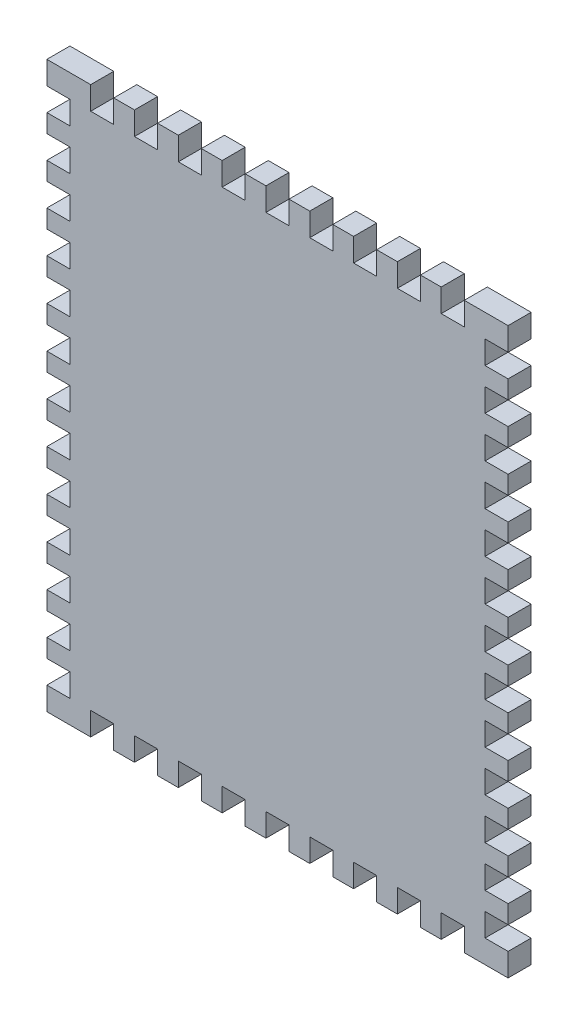
from build123d import *

# Parameters (mm, degrees)
ESBO_O1_W                = 120
ESBO_O1_H                = 147
RESSALTO_EXTRUS_O1_DEPTH = 6
CORTE_EXTRUS_O1_DEPTH    = 96.069711265
ESBO_O3_W                = 6
ESBO_O3_H                = 6
CORTE_EXTRUS_O2_DEPTH    = 96.069711265
PADR_O_LINEAR1_COUNT     = 7
PADR_O_LINEAR1_PITCH     = 10.75
PADR_O_LINEAR1_COL_COUNT = 7
PADR_O_LINEAR1_COL_PITCH = 10.75
PADR_O_LINEAR2_COUNT     = 5
PADR_O_LINEAR2_PITCH     = 11.4
PADR_O_LINEAR3_COUNT     = 5
PADR_O_LINEAR3_PITCH     = 11.4
ESBO_O4_W                = 6
ESBO_O4_H                = 6
CORTE_EXTRUS_O3_DEPTH    = 96.069711265
PADR_O_LINEAR4_COUNT     = 5
PADR_O_LINEAR4_PITCH     = 11.4
PADR_O_LINEAR5_COUNT     = 5
PADR_O_LINEAR5_PITCH     = 11.4


with BuildPart() as part:
    # Esboço1 → Ressalto-extrusão1 (new body)
    with BuildSketch(Plane.XY):
        Rectangle(ESBO_O1_W, ESBO_O1_H)
    extrude(amount=RESSALTO_EXTRUS_O1_DEPTH)

    # Esboço2 → Corte-extrusão1 (cut, symmetric)
    with BuildSketch(Plane.XY.offset(6)):
        Polygon((-3, 403.362470446), (-3, 73.5), (-3, 67.5), (3, 67.5), (3, 73.5), (3, 403.362470446), (3, 1063.087411339), (-3, 1063.087411339), align=None)
    corte_extrus_o1 = extrude(amount=CORTE_EXTRUS_O1_DEPTH, both=True, mode=Mode.SUBTRACT)

    # Esboço3 → Corte-extrusão2 (cut, through all)
    with BuildSketch(Plane.XY.offset(6)):
        with Locations((-57, 0)):
            Rectangle(ESBO_O3_W, ESBO_O3_H)
        with Locations((57, 0)):
            Rectangle(ESBO_O3_W, ESBO_O3_H)
    corte_extrus_o2 = extrude(amount=-CORTE_EXTRUS_O2_DEPTH, mode=Mode.SUBTRACT)

    # Padrão linear1: Corte-extrusão2 ×7
    with Locations(*[(0, i * PADR_O_LINEAR1_PITCH, 0) for i in range(1, PADR_O_LINEAR1_COUNT)]):
        add(corte_extrus_o2, mode=Mode.SUBTRACT)

    # Padrão linear1 col: Corte-extrusão2 ×7
    with Locations(*[(0, -i * PADR_O_LINEAR1_COL_PITCH, 0) for i in range(1, PADR_O_LINEAR1_COL_COUNT)]):
        add(corte_extrus_o2, mode=Mode.SUBTRACT)

    # Padrão linear2: Corte-extrusão1 ×5
    with Locations(*[(-i * PADR_O_LINEAR2_PITCH, 0, 0) for i in range(1, PADR_O_LINEAR2_COUNT)]):
        add(corte_extrus_o1, mode=Mode.SUBTRACT)

    # Padrão linear3: Corte-extrusão1 ×5
    with Locations(*[(i * PADR_O_LINEAR3_PITCH, 0, 0) for i in range(1, PADR_O_LINEAR3_COUNT)]):
        add(corte_extrus_o1, mode=Mode.SUBTRACT)

    # Esboço4 → Corte-extrusão3 (cut, through all)
    with BuildSketch(Plane.XY.offset(6)):
        with Locations((0, -70.5)):
            Rectangle(ESBO_O4_W, ESBO_O4_H)
    corte_extrus_o3 = extrude(amount=-CORTE_EXTRUS_O3_DEPTH, mode=Mode.SUBTRACT)

    # Padrão linear4: Corte-extrusão3 ×5
    with Locations(*[(-i * PADR_O_LINEAR4_PITCH, 0, 0) for i in range(1, PADR_O_LINEAR4_COUNT)]):
        add(corte_extrus_o3, mode=Mode.SUBTRACT)

    # Padrão linear5: Corte-extrusão3 ×5
    with Locations(*[(i * PADR_O_LINEAR5_PITCH, 0, 0) for i in range(1, PADR_O_LINEAR5_COUNT)]):
        add(corte_extrus_o3, mode=Mode.SUBTRACT)


solid = part.part
